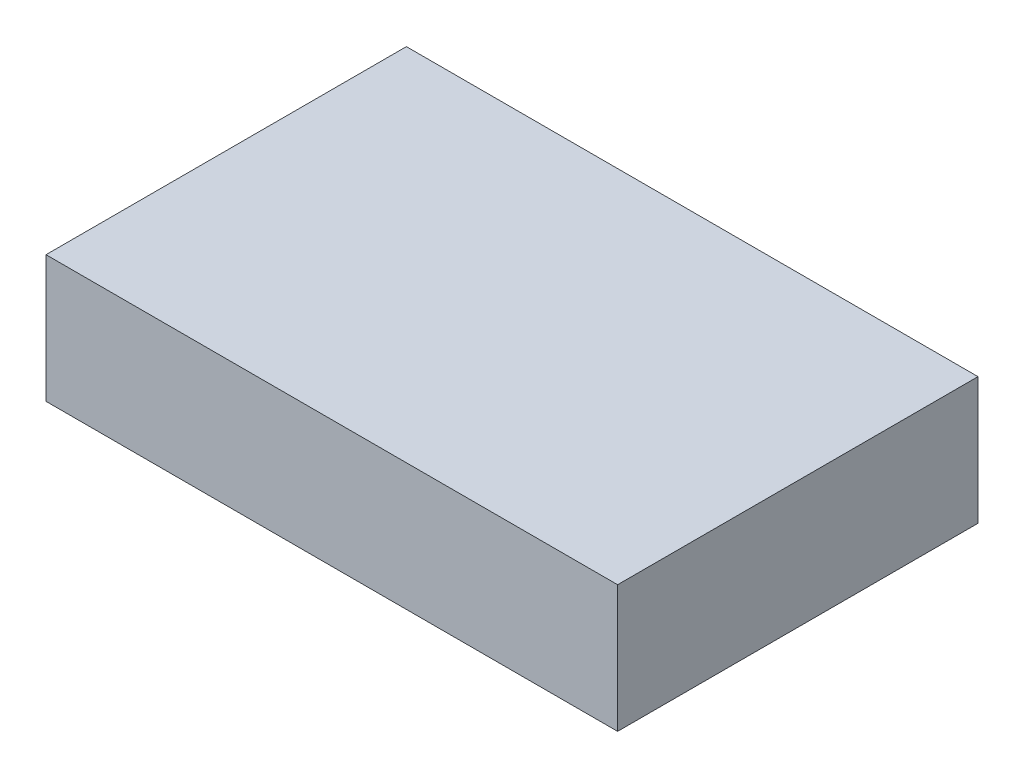
from build123d import *

# Parameters (mm, degrees)
SKETCH1_W           = 58.05
SKETCH1_H           = 36.6
BOSS_EXTRUDE2_DEPTH = 12.9


with BuildPart() as part:
    # Sketch1 → Boss-Extrude2 (new body)
    with BuildSketch(Plane(origin=(0, 0, 0), x_dir=(1, 0, 0), z_dir=(0, 1, 0))):
        Rectangle(SKETCH1_W, SKETCH1_H)
    extrude(amount=BOSS_EXTRUDE2_DEPTH)


solid = part.part
